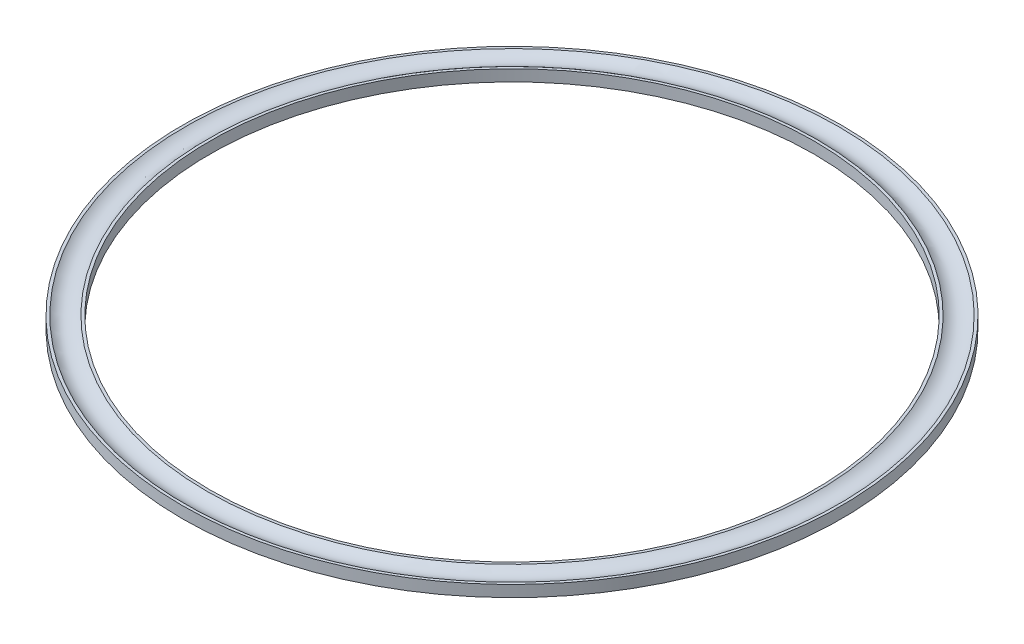
from build123d import *


with BuildPart() as part:
    # Sketch1 → Revolve2 (revolve)
    with BuildSketch(Plane.XY, mode=Mode.PRIVATE) as revolve2_sk:
        with BuildLine():
            Line((55.8038, -0.9652), (55.8038, 0.9652))
            Line((55.8038, 0.9652), (55.33898, 0.9652))
            ThreePointArc((55.33898, 0.9652), (53.4797, 0.29972), (51.62042, 0.9652))
            Line((51.62042, 0.9652), (51.1556, 0.9652))
            Line((51.1556, 0.9652), (51.1556, -0.9652))
            Line((51.1556, -0.9652), (55.8038, -0.9652))
        make_face()
    revolve(revolve2_sk.sketch.rotate(Axis((0, -11.412625366, 0), (0, 1, 0)), 90), axis=Axis((0, -11.412625366, 0), (0, 1, 0)))


solid = part.part
